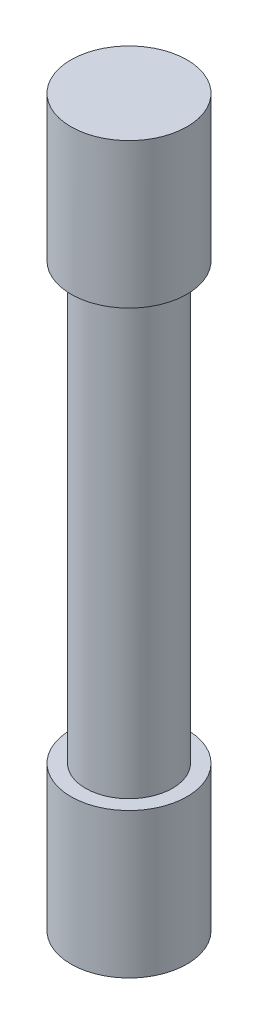
from build123d import *

# Parameters (mm, degrees)
SKETCH1_R           = 4
BOSS_EXTRUDE1_DEPTH = 50
SKETCH2_R           = 5.534283494
SKETCH2_R_2         = 3
CUT_EXTRUDE1_DEPTH  = 15
SKETCH4_R           = 4
SKETCH4_R_2         = 3
CUT_EXTRUDE2_DEPTH  = 15


with BuildPart() as part:
    # Sketch1 → Boss-Extrude1 (new body)
    with BuildSketch(Plane(origin=(0, 0, 0), x_dir=(1, 0, 0), z_dir=(0, 1, 0))):
        with Locations(Location((0, 0, 0), (0, 0, 270))):
            Circle(SKETCH1_R)
    extrude(amount=BOSS_EXTRUDE1_DEPTH)

    # Sketch2 → Cut-Extrude1 (cut)
    with BuildSketch(Plane(origin=(0, 25, 0), x_dir=(1, 0, 0), z_dir=(0, 1, 0))):
        Circle(SKETCH2_R)
        with Locations(Location((0, 0, 0), (0, 0, 270))):
            Circle(SKETCH2_R_2, mode=Mode.SUBTRACT)
    extrude(amount=-CUT_EXTRUDE1_DEPTH, mode=Mode.SUBTRACT)

    # Sketch4 → Cut-Extrude2 (cut)
    with BuildSketch(Plane.XZ.offset(-25)):
        with Locations(Location((0, 0, 0), (0, 0, 90))):
            Circle(SKETCH4_R)
        with Locations(Location((0, 0, 0), (0, 0, 90))):
            Circle(SKETCH4_R_2, mode=Mode.SUBTRACT)
    extrude(amount=-CUT_EXTRUDE2_DEPTH, mode=Mode.SUBTRACT)


solid = part.part
